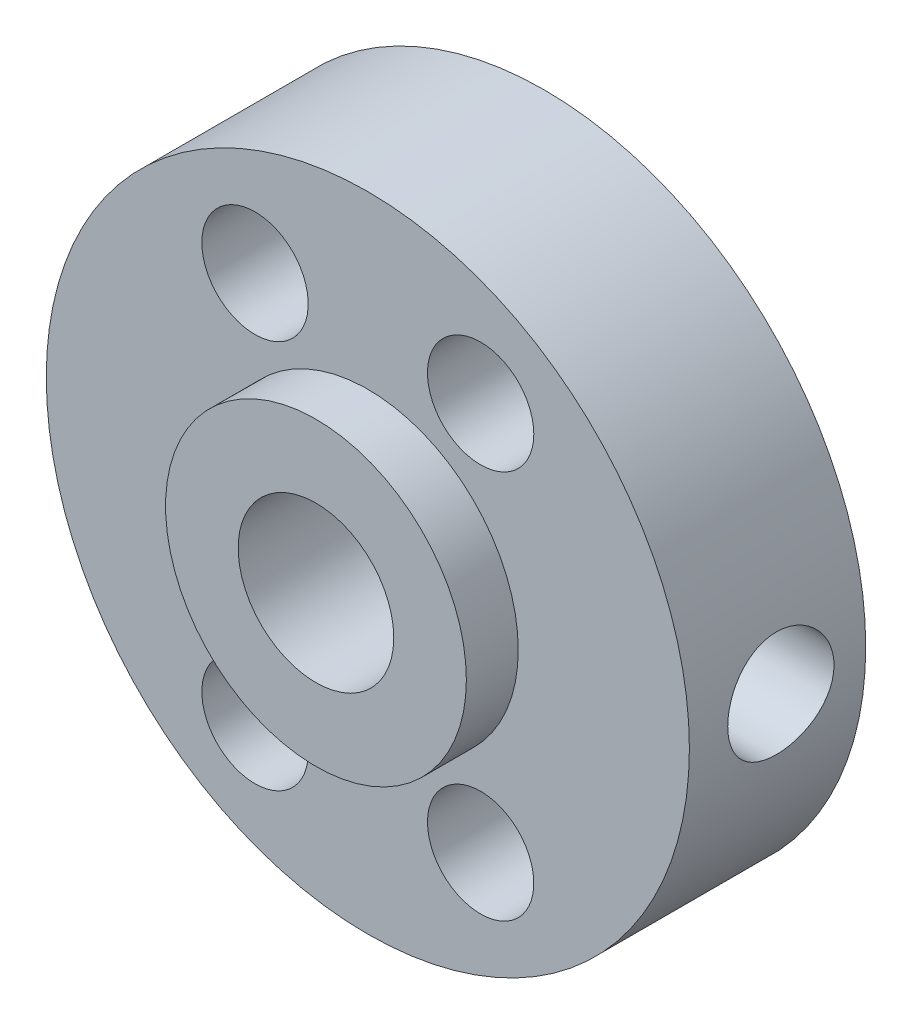
from build123d import *

# Parameters (mm, degrees)
SKETCH1_R           = 12.4
BOSS_EXTRUDE1_DEPTH = 6.8
SKETCH2_R           = 5.8
BOSS_EXTRUDE2_DEPTH = 2
SKETCH3_R           = 3
CUT_EXTRUDE1_DEPTH  = 20.620397549
SKETCH4_R           = 2.05
CUT_EXTRUDE2_DEPTH  = 19.808508713
SKETCH5_R           = 2.05
CUT_EXTRUDE3_DEPTH  = 6


with BuildPart() as part:
    # Sketch1 → Boss-Extrude1 (new body)
    with BuildSketch(Plane.XY):
        Circle(SKETCH1_R)
    extrude(amount=BOSS_EXTRUDE1_DEPTH)

    # Sketch2 → Boss-Extrude2 (add)
    with BuildSketch(Plane.XY.offset(6.8)):
        Circle(SKETCH2_R)
    extrude(amount=BOSS_EXTRUDE2_DEPTH)

    # Sketch3 → Cut-Extrude1 (cut, through all)
    with BuildSketch(Plane.XY.offset(8.8)):
        Circle(SKETCH3_R)
    extrude(amount=-CUT_EXTRUDE1_DEPTH, mode=Mode.SUBTRACT)

    # Sketch4 → Cut-Extrude2 (cut, through all)
    with BuildSketch(Plane.XY.offset(6.8)):
        with Locations((4.35, 7.5)):
            Circle(SKETCH4_R)
        with Locations(Location((-4.35, 7.5, 0), (0, 0, 180))):
            Circle(SKETCH4_R)
        with Locations(Location((4.35, -7.5, 0), (0, 0, 180))):
            Circle(SKETCH4_R)
        with Locations((-4.35, -7.5)):
            Circle(SKETCH4_R)
    extrude(amount=-CUT_EXTRUDE2_DEPTH, mode=Mode.SUBTRACT)

    # Sketch5 → Cut-Extrude3 (cut)
    with BuildSketch(Plane(origin=(12.4, 0, 0), x_dir=(0, 0, -1), z_dir=(1, 0, 0))):
        with Locations((-3.271849547, 0)):
            Circle(SKETCH5_R)
    extrude(amount=-CUT_EXTRUDE3_DEPTH, mode=Mode.SUBTRACT)


solid = part.part
